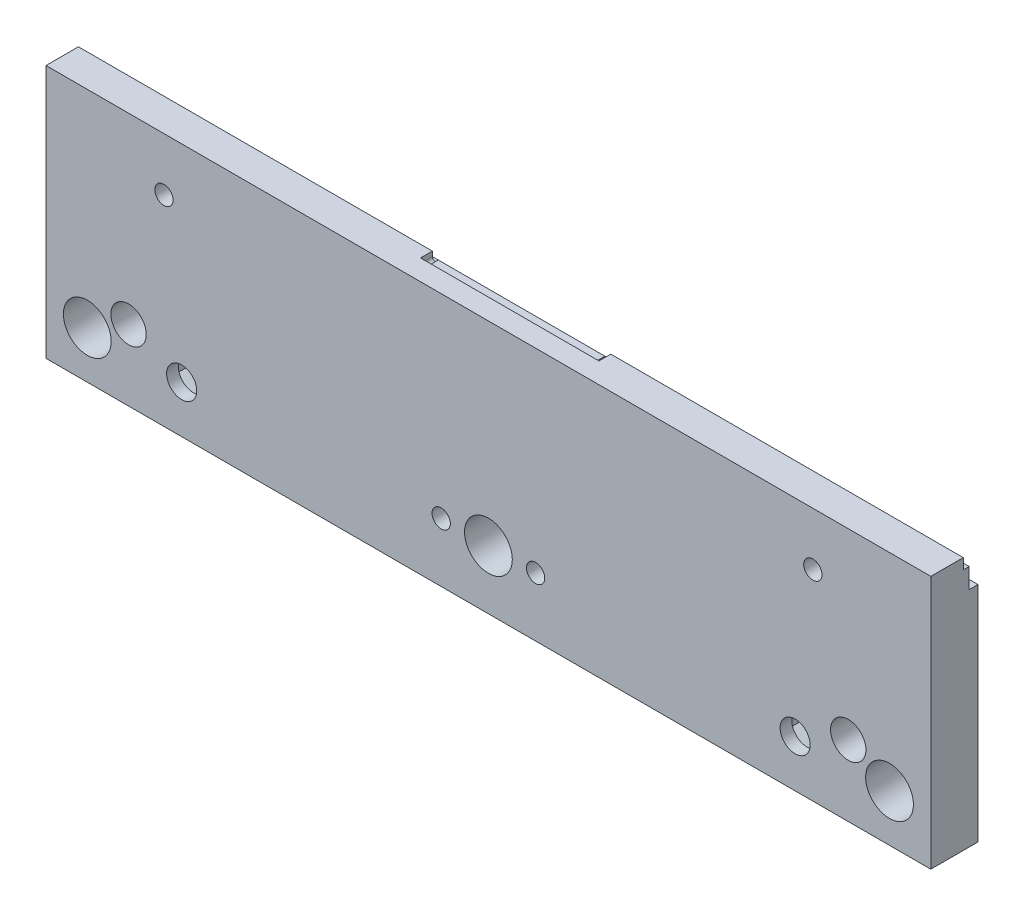
from build123d import *

# Parameters (mm, degrees)
SKETCH_2_W           = 150
SKETCH_2_H           = 43
SKETCH_2_R           = 4.05
EXTRUDE_1_DEPTH      = 8
SKETCH_3_R           = 2.55
CUT_EXTRUDE_1_DEPTH  = 157.246599963
CUT_EXTRUDE_2_DEPTH  = 157.246599963
SKETCH_5_R           = 1.55
CUT_EXTRUDE_3_DEPTH  = 157.246599963
CUT_EXTRUDE_15_DEPTH = 4.5
SKETCH_11_R          = 1.55
CUT_EXTRUDE_7_DEPTH  = 157.246599963
CUT_EXTRUDE_11_DEPTH = 2
SKETCH_21_R          = 3
CUT_EXTRUDE_13_DEPTH = 157.246599963
CUT_EXTRUDE_14_DEPTH = 6


with BuildPart() as part:
    # 草图2 → 凸台-拉伸1 (new body)
    with BuildSketch(Plane.XY):
        with Locations((75, 21.5)):
            Rectangle(SKETCH_2_W, SKETCH_2_H)
        with Locations((7, 8)):
            Circle(SKETCH_2_R, mode=Mode.SUBTRACT)
        with Locations((75, 10)):
            Circle(SKETCH_2_R, mode=Mode.SUBTRACT)
        with Locations((143, 8)):
            Circle(SKETCH_2_R, mode=Mode.SUBTRACT)
    extrude(amount=EXTRUDE_1_DEPTH)

    # 草图3 → 切除-拉伸1 (cut, through all)
    with BuildSketch(Plane.XY.offset(8)):
        with Locations((23, 8)):
            Circle(SKETCH_3_R)
        with Locations((127, 8)):
            Circle(SKETCH_3_R)
    extrude(amount=-CUT_EXTRUDE_1_DEPTH, mode=Mode.SUBTRACT)

    # 草图4 → 切除-拉伸2 (cut, through all)
    with BuildSketch(Plane(origin=(150, 0, 0), x_dir=(0, 0, -1), z_dir=(1, 0, 0))):
        Polygon((-1.5, 41.2), (-2.5, 41.2), (-2.5, 43), (0, 43), (0, 37.8), (-1.5, 37.8), align=None)
    extrude(amount=-CUT_EXTRUDE_2_DEPTH, mode=Mode.SUBTRACT)

    # 草图5 → 切除-拉伸3 (cut, through all)
    with BuildSketch(Plane.XY.offset(8)):
        with Locations((83, 10)):
            Circle(SKETCH_5_R)
        with Locations((67, 10)):
            Circle(SKETCH_5_R)
    extrude(amount=-CUT_EXTRUDE_3_DEPTH, mode=Mode.SUBTRACT)

    # 草图8 → 切除-拉伸15 (cut)
    with BuildSketch(Plane(origin=(0, 0, 0), x_dir=(-1, 0, 0), z_dir=(0, 0, -1))):
        Polygon((-83, 6.709103466), (-80.15, 8.354551733), (-80.15, 11.645448267), (-83, 13.290896534), (-85.85, 11.645448267), (-85.85, 8.354551733), align=None)
        Polygon((-69.85, 11.645448267), (-69.85, 8.354551733), (-67, 6.709103466), (-64.15, 8.354551733), (-64.15, 11.645448267), (-67, 13.290896534), align=None)
    extrude(amount=-CUT_EXTRUDE_15_DEPTH, mode=Mode.SUBTRACT)

    # 草图11 → 切除-拉伸7 (cut, through all)
    with BuildSketch(Plane(origin=(0, 0, 0), x_dir=(-1, 0, 0), z_dir=(0, 0, -1))):
        with Locations((-130, 34)):
            Circle(SKETCH_11_R)
        with Locations((-20, 34)):
            Circle(SKETCH_11_R)
    extrude(amount=-CUT_EXTRUDE_7_DEPTH, mode=Mode.SUBTRACT)

    # 草图19 → 切除-拉伸11 (cut)
    with BuildSketch(Plane(origin=(0, 0, 2.5), x_dir=(-1, 0, 0), z_dir=(0, 0, -1))):
        with BuildLine():
            Line((-60, 43), (-90.247938178, 43))
            Line((-90.247938178, 43), (-90.247938178, 42.2))
            ThreePointArc((-90.247938178, 42.2), (-89.747938178, 41.7), (-89.247938178, 42.2))
            Line((-89.247938178, 42.2), (-61, 42.2))
            ThreePointArc((-61, 42.2), (-60.5, 41.7), (-60, 42.2))
            Line((-60, 42.2), (-60, 43))
        make_face()
    extrude(amount=-CUT_EXTRUDE_11_DEPTH, mode=Mode.SUBTRACT)

    # 草图21 → 切除-拉伸13 (cut, through all)
    with BuildSketch(Plane(origin=(0, 0, 0), x_dir=(-1, 0, 0), z_dir=(0, 0, -1))):
        with Locations((-14, 12)):
            Circle(SKETCH_21_R)
        with Locations(Location((-136, 12, 0), (0, 0, 180))):
            Circle(SKETCH_21_R)
    extrude(amount=-CUT_EXTRUDE_13_DEPTH, mode=Mode.SUBTRACT)

    # 草图22 → 切除-拉伸14 (cut)
    with BuildSketch(Plane(origin=(0, 0, 0), x_dir=(-1, 0, 0), z_dir=(0, 0, -1))):
        Polygon((-122.9, 5.632863896), (-122.9, 10.367136104), (-127, 12.734272207), (-131.1, 10.367136104), (-131.1, 5.632863896), (-127, 3.265727793), align=None)
        Polygon((-23, 3.265727793), (-18.9, 5.632863896), (-18.9, 10.367136104), (-23, 12.734272207), (-27.1, 10.367136104), (-27.1, 5.632863896), align=None)
    extrude(amount=-CUT_EXTRUDE_14_DEPTH, mode=Mode.SUBTRACT)


solid = part.part
